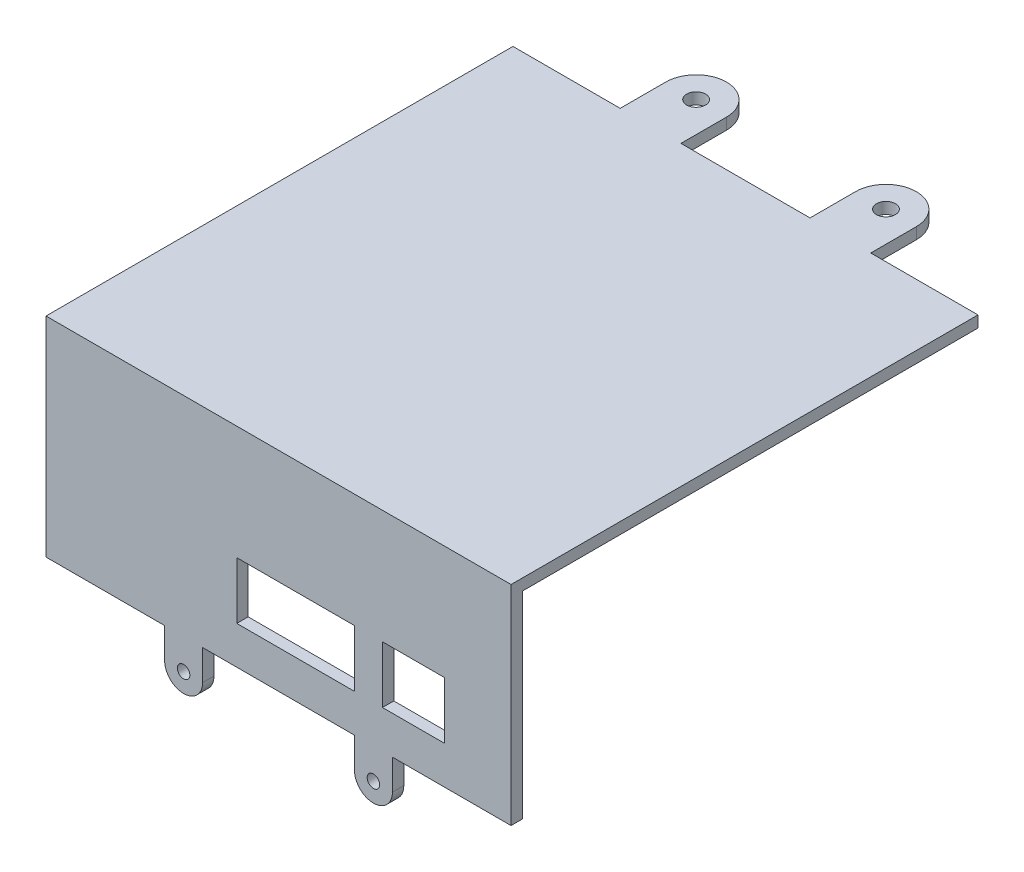
from build123d import *

# Parameters (mm, degrees)
SKETCH_1_W           = 122.5
SKETCH_1_H           = 120
EXTRUDE_1_DEPTH      = 3
EXTRUDE_2_DEPTH      = 61.25
EXTRUDE_2_DEPTH_BACK = 61.25
SKETCH_5_W           = 3
SKETCH_5_H           = 55
EXTRUDE_3_DEPTH      = 3
HOLE_WIZARD_M6_1_D   = 5
EXTRUDE_4_DEPTH      = 3
HOLE_WIZARD_M4_3_D   = 3.3
SKETCH_29_W          = 31
SKETCH_29_H          = 15
SKETCH_29_W_2        = 16.3
CUT_EXTRUDE_1_DEPTH  = 169.59882117


with BuildPart() as part:
    # 草图1 → 凸台-拉伸1 (new body)
    with BuildSketch(Plane(origin=(0, 0, 0), x_dir=(1, 0, 0), z_dir=(0, 1, 0))):
        Rectangle(SKETCH_1_W, SKETCH_1_H)
    extrude(amount=EXTRUDE_1_DEPTH)

    # 草图5 → 凸台-拉伸2 (add, two sides: drawn at the far end of the back side and taken through both)
    with BuildSketch(Plane(origin=(0, 0, 0), x_dir=(0, 0, -1), z_dir=(1, 0, 0)).offset(-EXTRUDE_2_DEPTH_BACK)):
        with Locations((-61.5, -24.5)):
            Rectangle(SKETCH_5_W, SKETCH_5_H)
    extrude(amount=EXTRUDE_2_DEPTH + EXTRUDE_2_DEPTH_BACK)

    # 草图23 → 凸台-拉伸3 (add)
    with BuildSketch(Plane(origin=(0, 3, 0), x_dir=(1, 0, 0), z_dir=(0, 1, 0))):
        with BuildLine():
            Line((17, 60), (33, 60))
            Line((33, 60), (33, 72))
            ThreePointArc((33, 72), (25, 80), (17, 72))
            Line((17, 72), (17, 60))
        make_face()
        with BuildLine():
            Line((-17, 60), (-17, 72))
            ThreePointArc((-17, 72), (-25, 80), (-33, 72))
            Line((-33, 72), (-33, 60))
            Line((-33, 60), (-17, 60))
        make_face()
    extrude(amount=-EXTRUDE_3_DEPTH)

    # M6 螺纹孔1 (through all)
    with Locations(Plane(origin=(0, 3, 0), x_dir=(1, 0, 0), z_dir=(0, 1, 0))):
        with Locations((-25, 72), (25, 72)):
            Hole(HOLE_WIZARD_M6_1_D / 2)

    # 草图26 → 凸台-拉伸4 (add)
    with BuildSketch(Plane.XY.offset(63)):
        with BuildLine():
            Line((-30, -52), (-20, -52))
            Line((-20, -52), (-20, -60))
            ThreePointArc((-20, -60), (-25, -65), (-30, -60))
            Line((-30, -60), (-30, -52))
        make_face()
        with BuildLine():
            Line((30, -52), (20, -52))
            Line((20, -52), (20, -60))
            ThreePointArc((20, -60), (25, -65), (30, -60))
            Line((30, -60), (30, -52))
        make_face()
    extrude(amount=-EXTRUDE_4_DEPTH)

    # M4 螺纹孔3 (through all)
    with Locations(Plane.XY.offset(63)):
        with Locations((-25, -60)):
            hole_wizard_m4_3 = Hole(HOLE_WIZARD_M4_3_D / 2)

    # 镜向8: M4 螺纹孔3 across plane
    add(hole_wizard_m4_3.mirror(Plane(origin=(0, 0, 0), x_dir=(0, 0, 1), z_dir=(1, 0, 0))), mode=Mode.SUBTRACT)

    # 草图29 → 切除-拉伸1 (cut, through all)
    with BuildSketch(Plane.XY.offset(63)):
        with Locations((4.5, -34.5)):
            Rectangle(SKETCH_29_W, SKETCH_29_H)
        with Locations((35.52, -34.5)):
            Rectangle(SKETCH_29_W_2, SKETCH_29_H)
    extrude(amount=-CUT_EXTRUDE_1_DEPTH, mode=Mode.SUBTRACT)


solid = part.part
